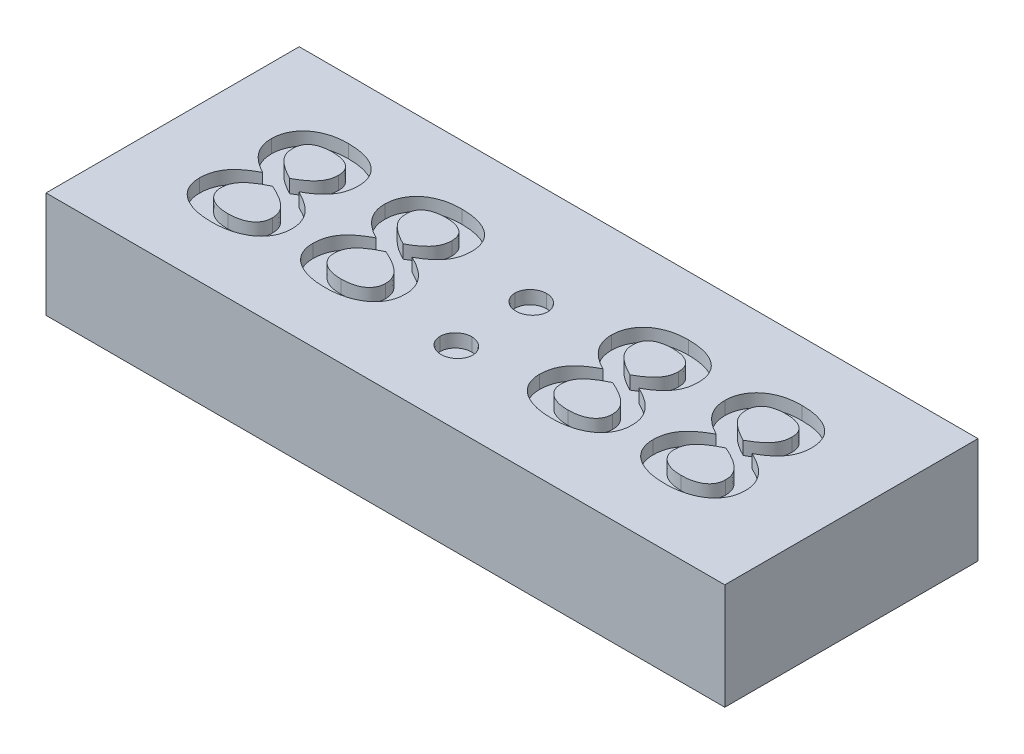
from build123d import *

# Parameters (mm, degrees)
SKETCH1_W           = 51.2
SKETCH1_H           = 19.1
BOSS_EXTRUDE1_DEPTH = 8
CUT_EXTRUDE1_DEPTH  = 1


with BuildPart() as part:
    # Sketch1 → Boss-Extrude1 (new body)
    with BuildSketch(Plane(origin=(0, 0, 0), x_dir=(1, 0, 0), z_dir=(0, 1, 0))):
        with Locations((25.6, 9.55)):
            Rectangle(SKETCH1_W, SKETCH1_H)
    extrude(amount=BOSS_EXTRUDE1_DEPTH)

    # Sketch2 → Cut-Extrude1 (cut)
    # profile 1 of 6: a face of its own
    with BuildSketch(Plane(origin=(0, 8, 0), x_dir=(1, 0, 0), z_dir=(0, 1, 0))):
        with BuildLine():
            add(Edge.make_bspline(
                [(11.616741597, 6.938055716), (11.614070617, 6.83668319), (11.608853593, 6.638679913), (11.55719971, 6.351263833), (11.475585219, 6.081183562), (11.362340457, 5.829091725), (11.21796559, 5.596305898), (11.046741824, 5.382931628), (10.851420863, 5.186004605), (10.627290932, 5.012943543), (10.383503663, 4.855466968), (10.115222336, 4.723591964), (9.829972053, 4.603321067), (9.52197921, 4.510754949), (9.19747259, 4.435759615), (8.858560281, 4.381717349), (8.505943694, 4.349779848), (8.266867884, 4.345250594), (8.145274206, 4.34294702)],
                knots=[0, 0, 0, 0, 1.000052693, 1.953327181, 2.872788888, 3.780118478, 4.673629746, 5.569872142, 6.476313619, 7.405181598, 8.360347939, 9.33693613, 10.352831955, 11.413662562, 12.507440117, 13.639596934, 14.79950176, 16, 16, 16, 16], degree=3))
            add(Edge.make_bspline(
                [(8.145274206, 4.34294702), (8.012328382, 4.344851988), (7.755034304, 4.348538731), (7.380878181, 4.38459316), (7.030424636, 4.4356505), (6.705217621, 4.516167678), (6.405308406, 4.615349798), (6.130563802, 4.7333785), (5.879564374, 4.866714686), (5.653766423, 5.018028988), (5.456473556, 5.189397483), (5.282277172, 5.373638271), (5.133656842, 5.573749412), (5.014045668, 5.789706396), (4.919539334, 6.018258741), (4.8556149, 6.259034913), (4.812374573, 6.510033624), (4.807582488, 6.681227018), (4.805147394, 6.76821876)],
                knots=[0, 0, 0, 0, 1.375053455, 2.661182599, 3.886103685, 5.035847984, 6.122484779, 7.151019323, 8.125850463, 9.059422521, 9.956479377, 10.823913521, 11.678312387, 12.527879149, 13.371936083, 14.230181046, 15.100668371, 16, 16, 16, 16], degree=3))
            add(Edge.make_bspline(
                [(4.805147394, 6.76821876), (4.805963618, 6.842281797), (4.807567724, 6.987836158), (4.834785732, 7.201783243), (4.872219033, 7.408672939), (4.926227231, 7.608174253), (4.997920808, 7.798935921), (5.080071781, 7.983983861), (5.184317545, 8.157789763), (5.299189806, 8.327653812), (5.43534249, 8.488101149), (5.584228721, 8.646896776), (5.751253789, 8.802184627), (5.93550008, 8.952074416), (6.137027044, 9.09805574), (6.353849691, 9.240179371), (6.588243389, 9.378951888), (6.752240869, 9.465900935), (6.836397394, 9.510519484)],
                knots=[0, 0, 0, 0, 0.9817941, 1.929497053, 2.856500519, 3.769882858, 4.666479047, 5.558197062, 6.451263441, 7.351208482, 8.27561226, 9.239003338, 10.238008998, 11.298365388, 12.387964643, 13.537787702, 14.736497464, 16, 16, 16, 16], degree=3))
            add(Edge.make_bspline(
                [(6.836397394, 9.510519484), (6.756763409, 9.552866842), (6.601798715, 9.635273184), (6.381007866, 9.767304862), (6.176726507, 9.903032609), (5.989272847, 10.042916902), (5.817902036, 10.186065284), (5.664209087, 10.333416925), (5.524846991, 10.483111107), (5.362604237, 10.686320845), (5.198868313, 10.958368942), (5.052255626, 11.306865326), (4.967628578, 11.680437283), (4.955987203, 11.936888607), (4.950074931, 12.067131803)],
                knots=[0, 0, 0, 0, 0.965742151, 1.879297357, 2.753639218, 3.591069971, 4.3828202, 5.143208522, 5.869671325, 6.57156934, 7.92459772, 9.2546127, 10.605708044, 12, 12, 12, 12], degree=3))
            add(Edge.make_bspline(
                [(4.950074931, 12.067131803), (4.953070202, 12.148764825), (4.959034, 12.311301988), (4.995451377, 12.553860244), (5.060049035, 12.790660038), (5.14526452, 13.023968196), (5.259610452, 13.246883566), (5.394922441, 13.462080986), (5.559807905, 13.661452669), (5.74912009, 13.848464636), (5.963337707, 14.020133031), (6.20476818, 14.172623778), (6.469522813, 14.308822069), (6.761721988, 14.42365023), (7.078878878, 14.520896773), (7.424746354, 14.583280305), (7.795474014, 14.625981744), (8.051541316, 14.630479513), (8.183770583, 14.632802093)],
                knots=[0, 0, 0, 0, 0.84787631, 1.688182144, 2.539998808, 3.393220902, 4.262601171, 5.136739024, 6.028000719, 6.942569753, 7.896211159, 8.872552016, 9.903233579, 10.98328609, 12.129012318, 13.341973747, 14.627435608, 16, 16, 16, 16], degree=3))
            add(Edge.make_bspline(
                [(8.183770583, 14.632802093), (8.309149164, 14.630634447), (8.552021391, 14.626435475), (8.90447337, 14.593982383), (9.234145031, 14.543591979), (9.539743529, 14.468432686), (9.822301432, 14.375637563), (10.082476562, 14.265318812), (10.317877977, 14.133695214), (10.530844875, 13.985680193), (10.719718595, 13.821076693), (10.881313599, 13.637122569), (11.022297989, 13.439969792), (11.13129635, 13.222517108), (11.221955576, 12.993557654), (11.280843421, 12.748757472), (11.321983338, 12.492741713), (11.325234249, 12.317153511), (11.326886525, 12.227910789)],
                knots=[0, 0, 0, 0, 1.344488315, 2.60442309, 3.792969015, 4.918061287, 5.975373753, 6.979920341, 7.943949441, 8.862512087, 9.75736589, 10.623298353, 11.483497483, 12.348862108, 13.225364058, 14.118751848, 15.043855425, 16, 16, 16, 16], degree=3))
            add(Edge.make_bspline(
                [(11.326886525, 12.227910789), (11.325822205, 12.154626009), (11.323732064, 12.010707253), (11.300078221, 11.798756685), (11.262880578, 11.595447966), (11.206362221, 11.400866347), (11.140574061, 11.213398127), (11.055059947, 11.03506781), (10.955609785, 10.865534322), (10.801820285, 10.647566708), (10.57106611, 10.392081357), (10.248238062, 10.107773709), (9.875465395, 9.840948329), (9.599294428, 9.688847538), (9.45641551, 9.610157165)],
                knots=[0, 0, 0, 0, 0.774346025, 1.520682966, 2.251503645, 2.956246805, 3.660447715, 4.349292367, 5.043110025, 5.73600945, 7.165967233, 8.669478215, 10.276932036, 12, 12, 12, 12], degree=3))
            add(Edge.make_bspline(
                [(9.45641551, 9.610157165), (9.605579079, 9.536165177), (9.898380952, 9.390921986), (10.309139325, 9.138626894), (10.682462397, 8.864338668), (10.951620753, 8.602959166), (11.138653059, 8.380853796), (11.261807789, 8.205328888), (11.368649717, 8.019918858), (11.456199234, 7.823649259), (11.531410069, 7.619622712), (11.579094338, 7.401695637), (11.613027829, 7.173878727), (11.615491338, 7.017446769), (11.616741597, 6.938055716)],
                knots=[0, 0, 0, 0, 1.642200187, 3.223570591, 4.7503837, 6.204073382, 6.912600226, 7.613056352, 8.316988316, 9.020289587, 9.731707272, 10.457979509, 11.217406522, 12, 12, 12, 12], degree=3))
        make_face()
        with BuildLine():
            add(Edge.make_bspline(
                [(9.877611162, 12.182620934), (9.876685369, 12.235573226), (9.874890593, 12.338228372), (9.850312323, 12.485752458), (9.817809639, 12.62395572), (9.767195123, 12.751813563), (9.702247628, 12.869507711), (9.620968355, 12.975165261), (9.527418441, 13.070871724), (9.382500435, 13.187990954), (9.163962583, 13.306760489), (8.860794779, 13.404813539), (8.512048852, 13.462886031), (8.264773499, 13.469750262), (8.133951742, 13.473381803)],
                knots=[0, 0, 0, 0, 0.772738455, 1.498057474, 2.180163254, 2.84373868, 3.500404073, 4.137895351, 4.785232637, 5.451825786, 6.854070669, 8.388647673, 10.089403371, 12, 12, 12, 12], degree=3))
            add(Edge.make_bspline(
                [(8.133951742, 13.473381803), (8.004622347, 13.469777718), (7.759569401, 13.462948707), (7.414270411, 13.404267785), (7.112498601, 13.30879296), (6.895092181, 13.191889022), (6.749672913, 13.077693309), (6.65541499, 12.984067539), (6.575528414, 12.879953613), (6.512950274, 12.764420549), (6.457945604, 12.642172251), (6.427219718, 12.506737872), (6.40193208, 12.363209499), (6.400229302, 12.263520709), (6.399350293, 12.212059339)],
                knots=[0, 0, 0, 0, 1.91446195, 3.627516704, 5.169007738, 6.585059734, 7.253819462, 7.902078826, 8.548310414, 9.189005685, 9.845218274, 10.525835054, 11.239006242, 12, 12, 12, 12], degree=3))
            add(Edge.make_bspline(
                [(6.399350293, 12.212059339), (6.404400239, 12.107377969), (6.414297631, 11.902212885), (6.497736053, 11.605806803), (6.644334962, 11.332981655), (6.851068831, 11.079434879), (7.117542419, 10.84077986), (7.43530157, 10.600295974), (7.817509, 10.366295782), (8.09683739, 10.218432257), (8.244911887, 10.14004847)],
                knots=[0, 0, 0, 0, 0.855423649, 1.676545345, 2.494246317, 3.372850179, 4.338686428, 5.414450719, 6.629377019, 8, 8, 8, 8], degree=3))
            add(Edge.make_bspline(
                [(8.244911887, 10.14004847), (8.375241461, 10.212695306), (8.623212056, 10.350916269), (8.958058254, 10.580701151), (9.241221947, 10.813701471), (9.47619781, 11.052557977), (9.657160514, 11.308188373), (9.786888243, 11.581918186), (9.863807121, 11.876521748), (9.87296144, 12.07951517), (9.877611162, 12.182620934)],
                knots=[0, 0, 0, 0, 1.297113997, 2.467944293, 3.526158232, 4.482572832, 5.373167372, 6.236538477, 7.104290941, 8, 8, 8, 8], degree=3))
        make_face(mode=Mode.SUBTRACT)
        with BuildLine():
            add(Edge.make_bspline(
                [(10.167466235, 6.901823832), (10.16326064, 6.992841626), (10.154827752, 7.175346785), (10.09358742, 7.397961735), (10.021725153, 7.571192922), (9.948353898, 7.701402833), (9.854984919, 7.829197786), (9.745029852, 7.956972496), (9.617329864, 8.085285417), (9.467209139, 8.210257368), (9.298868816, 8.338583764), (9.108228112, 8.464281691), (8.894410195, 8.592632627), (8.656531208, 8.723520253), (8.389087389, 8.851794177), (8.202054462, 8.9364688), (8.104513336, 8.98062818)],
                knots=[0, 0, 0, 0, 1.227361749, 2.461055587, 3.091438311, 3.75771563, 4.473384361, 5.225159627, 6.032379059, 6.914620528, 7.86051044, 8.889517349, 9.996022338, 11.227609097, 12.55414695, 14, 14, 14, 14], degree=3))
            add(Edge.make_bspline(
                [(8.104513336, 8.98062818), (8.021240533, 8.940353077), (7.859538461, 8.862145459), (7.629298232, 8.740917734), (7.420009742, 8.618422286), (7.177602659, 8.460197444), (6.913082811, 8.266799381), (6.657555756, 8.015711267), (6.465157949, 7.758445265), (6.336736372, 7.489798479), (6.267086742, 7.207335435), (6.258696087, 7.015418082), (6.254422757, 6.917675281)],
                knots=[0, 0, 0, 0, 0.943368346, 1.831865993, 2.653115838, 3.415419435, 4.784210071, 5.987266204, 7.055884212, 8.044200493, 9.003918514, 10, 10, 10, 10], degree=3))
            add(Edge.make_bspline(
                [(6.254422757, 6.917675281), (6.255790707, 6.862396758), (6.258472428, 6.754029053), (6.290500294, 6.597230349), (6.333520047, 6.448241809), (6.401562887, 6.311726904), (6.48266024, 6.184744917), (6.579137781, 6.068310517), (6.688583669, 5.961542791), (6.85400176, 5.828835049), (7.101361487, 5.696519748), (7.436774963, 5.581195322), (7.812830834, 5.514742297), (8.075574498, 5.506575159), (8.210944496, 5.50236731)],
                knots=[0, 0, 0, 0, 0.734446881, 1.439805529, 2.122996951, 2.79246048, 3.461245307, 4.124955764, 4.799824334, 5.493278862, 6.941275336, 8.504365142, 10.198989568, 12, 12, 12, 12], degree=3))
            add(Edge.make_bspline(
                [(8.210944496, 5.50236731), (8.342533091, 5.505935519), (8.599029991, 5.512890791), (8.968684713, 5.57659876), (9.303068194, 5.681079206), (9.554242578, 5.802960941), (9.721450362, 5.930812886), (9.837492313, 6.03048082), (9.931052189, 6.149300958), (10.017321234, 6.273656485), (10.085608527, 6.412135186), (10.132690979, 6.564233508), (10.163394628, 6.72848583), (10.166079812, 6.842800514), (10.167466235, 6.901823832)],
                knots=[0, 0, 0, 0, 1.750641714, 3.412409478, 4.972656889, 6.406140501, 7.095417535, 7.771309275, 8.435144008, 9.101180268, 9.784204059, 10.480113466, 11.215247397, 12, 12, 12, 12], degree=3))
        make_face(mode=Mode.SUBTRACT)
    # profile 2 of 6: a face of its own
    with BuildSketch(Plane(origin=(0, 8, 0), x_dir=(1, 0, 0), z_dir=(0, 1, 0))):
        with BuildLine():
            add(Edge.make_bspline(
                [(20.167466235, 6.938055716), (20.164795254, 6.83668319), (20.15957823, 6.638679913), (20.107924348, 6.351263833), (20.026309857, 6.081183562), (19.913065095, 5.829091725), (19.768690228, 5.596305898), (19.597466462, 5.382931628), (19.402145501, 5.186004605), (19.17801557, 5.012943543), (18.934228301, 4.855466968), (18.665946974, 4.723591964), (18.38069669, 4.603321067), (18.072703847, 4.510754949), (17.748197228, 4.435759615), (17.409284919, 4.381717349), (17.056668332, 4.349779848), (16.817592521, 4.345250594), (16.695998844, 4.34294702)],
                knots=[0, 0, 0, 0, 1.000052693, 1.953327181, 2.872788888, 3.780118478, 4.673629746, 5.569872142, 6.476313619, 7.405181598, 8.360347939, 9.33693613, 10.352831955, 11.413662562, 12.507440117, 13.639596934, 14.79950176, 16, 16, 16, 16], degree=3))
            add(Edge.make_bspline(
                [(16.695998844, 4.34294702), (16.56305302, 4.344851988), (16.305758941, 4.348538731), (15.931602819, 4.38459316), (15.581149274, 4.4356505), (15.255942259, 4.516167678), (14.956033044, 4.615349798), (14.68128844, 4.7333785), (14.430289012, 4.866714686), (14.204491061, 5.018028988), (14.007198194, 5.189397483), (13.83300181, 5.373638271), (13.68438148, 5.573749412), (13.564770305, 5.789706396), (13.470263972, 6.018258741), (13.406339538, 6.259034913), (13.363099211, 6.510033624), (13.358307125, 6.681227018), (13.355872032, 6.76821876)],
                knots=[0, 0, 0, 0, 1.375053455, 2.661182599, 3.886103685, 5.035847984, 6.122484779, 7.151019323, 8.125850463, 9.059422521, 9.956479377, 10.823913521, 11.678312387, 12.527879149, 13.371936083, 14.230181046, 15.100668371, 16, 16, 16, 16], degree=3))
            add(Edge.make_bspline(
                [(13.355872032, 6.76821876), (13.356688256, 6.842281797), (13.358292361, 6.987836158), (13.38551037, 7.201783243), (13.422943671, 7.408672939), (13.476951868, 7.608174253), (13.548645445, 7.798935921), (13.630796418, 7.983983861), (13.735042183, 8.157789763), (13.849914443, 8.327653812), (13.986067127, 8.488101149), (14.134953358, 8.646896776), (14.301978427, 8.802184627), (14.486224718, 8.952074416), (14.687751681, 9.09805574), (14.904574329, 9.240179371), (15.138968027, 9.378951888), (15.302965507, 9.465900935), (15.387122032, 9.510519484)],
                knots=[0, 0, 0, 0, 0.9817941, 1.929497053, 2.856500519, 3.769882858, 4.666479047, 5.558197062, 6.451263441, 7.351208482, 8.27561226, 9.239003338, 10.238008998, 11.298365388, 12.387964643, 13.537787702, 14.736497464, 16, 16, 16, 16], degree=3))
            add(Edge.make_bspline(
                [(15.387122032, 9.510519484), (15.307488047, 9.552866842), (15.152523352, 9.635273184), (14.931732504, 9.767304862), (14.727451145, 9.903032609), (14.539997485, 10.042916902), (14.368626673, 10.186065284), (14.214933725, 10.333416925), (14.075571629, 10.483111107), (13.913328875, 10.686320845), (13.74959295, 10.958368942), (13.602980264, 11.306865326), (13.518353216, 11.680437283), (13.50671184, 11.936888607), (13.500799568, 12.067131803)],
                knots=[0, 0, 0, 0, 0.965742151, 1.879297357, 2.753639218, 3.591069971, 4.3828202, 5.143208522, 5.869671325, 6.57156934, 7.92459772, 9.2546127, 10.605708044, 12, 12, 12, 12], degree=3))
            add(Edge.make_bspline(
                [(13.500799568, 12.067131803), (13.503794839, 12.148764825), (13.509758638, 12.311301988), (13.546176014, 12.553860244), (13.610773673, 12.790660038), (13.695989158, 13.023968196), (13.81033509, 13.246883566), (13.945647079, 13.462080986), (14.110532543, 13.661452669), (14.299844728, 13.848464636), (14.514062345, 14.020133031), (14.755492818, 14.172623778), (15.020247451, 14.308822069), (15.312446625, 14.42365023), (15.629603516, 14.520896773), (15.975470991, 14.583280305), (16.346198652, 14.625981744), (16.602265954, 14.630479513), (16.73449522, 14.632802093)],
                knots=[0, 0, 0, 0, 0.84787631, 1.688182144, 2.539998808, 3.393220902, 4.262601171, 5.136739024, 6.028000719, 6.942569753, 7.896211159, 8.872552016, 9.903233579, 10.98328609, 12.129012318, 13.341973747, 14.627435608, 16, 16, 16, 16], degree=3))
            add(Edge.make_bspline(
                [(16.73449522, 14.632802093), (16.859873801, 14.630634447), (17.102746028, 14.626435475), (17.455198008, 14.593982383), (17.784869669, 14.543591979), (18.090468167, 14.468432686), (18.37302607, 14.375637563), (18.633201199, 14.265318812), (18.868602615, 14.133695214), (19.081569513, 13.985680193), (19.270443233, 13.821076693), (19.432038237, 13.637122569), (19.573022626, 13.439969792), (19.682020987, 13.222517108), (19.772680213, 12.993557654), (19.831568059, 12.748757472), (19.872707976, 12.492741713), (19.875958887, 12.317153511), (19.877611162, 12.227910789)],
                knots=[0, 0, 0, 0, 1.344488315, 2.60442309, 3.792969015, 4.918061287, 5.975373753, 6.979920341, 7.943949441, 8.862512087, 9.75736589, 10.623298353, 11.483497483, 12.348862108, 13.225364058, 14.118751848, 15.043855425, 16, 16, 16, 16], degree=3))
            add(Edge.make_bspline(
                [(19.877611162, 12.227910789), (19.876546843, 12.154626009), (19.874456701, 12.010707253), (19.850802858, 11.798756685), (19.813605216, 11.595447966), (19.757086859, 11.400866347), (19.691298699, 11.213398127), (19.605784585, 11.03506781), (19.506334423, 10.865534322), (19.352544923, 10.647566708), (19.121790748, 10.392081357), (18.7989627, 10.107773709), (18.426190033, 9.840948329), (18.150019065, 9.688847538), (18.007140148, 9.610157165)],
                knots=[0, 0, 0, 0, 0.774346025, 1.520682966, 2.251503645, 2.956246805, 3.660447715, 4.349292367, 5.043110025, 5.73600945, 7.165967233, 8.669478215, 10.276932036, 12, 12, 12, 12], degree=3))
            add(Edge.make_bspline(
                [(18.007140148, 9.610157165), (18.156303716, 9.536165177), (18.44910559, 9.390921986), (18.859863963, 9.138626894), (19.233187035, 8.864338668), (19.502345391, 8.602959166), (19.689377697, 8.380853796), (19.812532427, 8.205328888), (19.919374354, 8.019918858), (20.006923872, 7.823649259), (20.082134707, 7.619622712), (20.129818975, 7.401695637), (20.163752467, 7.173878727), (20.166215975, 7.017446769), (20.167466235, 6.938055716)],
                knots=[0, 0, 0, 0, 1.642200187, 3.223570591, 4.7503837, 6.204073382, 6.912600226, 7.613056352, 8.316988316, 9.020289587, 9.731707272, 10.457979509, 11.217406522, 12, 12, 12, 12], degree=3))
        make_face()
        with BuildLine():
            add(Edge.make_bspline(
                [(18.4283358, 12.182620934), (18.427410006, 12.235573226), (18.42561523, 12.338228372), (18.401036961, 12.485752458), (18.368534277, 12.62395572), (18.31791976, 12.751813563), (18.252972265, 12.869507711), (18.171692993, 12.975165261), (18.078143078, 13.070871724), (17.933225073, 13.187990954), (17.714687221, 13.306760489), (17.411519417, 13.404813539), (17.062773489, 13.462886031), (16.815498137, 13.469750262), (16.68467638, 13.473381803)],
                knots=[0, 0, 0, 0, 0.772738455, 1.498057474, 2.180163254, 2.84373868, 3.500404073, 4.137895351, 4.785232637, 5.451825786, 6.854070669, 8.388647673, 10.089403371, 12, 12, 12, 12], degree=3))
            add(Edge.make_bspline(
                [(16.68467638, 13.473381803), (16.555346985, 13.469777718), (16.310294039, 13.462948707), (15.964995048, 13.404267785), (15.663223239, 13.30879296), (15.445816819, 13.191889022), (15.300397551, 13.077693309), (15.206139628, 12.984067539), (15.126253051, 12.879953613), (15.063674912, 12.764420549), (15.008670241, 12.642172251), (14.977944356, 12.506737872), (14.952656718, 12.363209499), (14.950953939, 12.263520709), (14.950074931, 12.212059339)],
                knots=[0, 0, 0, 0, 1.91446195, 3.627516704, 5.169007738, 6.585059734, 7.253819462, 7.902078826, 8.548310414, 9.189005685, 9.845218274, 10.525835054, 11.239006242, 12, 12, 12, 12], degree=3))
            add(Edge.make_bspline(
                [(14.950074931, 12.212059339), (14.955124876, 12.107377969), (14.965022269, 11.902212885), (15.048460691, 11.605806803), (15.1950596, 11.332981655), (15.401793469, 11.079434879), (15.668267057, 10.84077986), (15.986026208, 10.600295974), (16.368233638, 10.366295782), (16.647562027, 10.218432257), (16.795636525, 10.14004847)],
                knots=[0, 0, 0, 0, 0.855423649, 1.676545345, 2.494246317, 3.372850179, 4.338686428, 5.414450719, 6.629377019, 8, 8, 8, 8], degree=3))
            add(Edge.make_bspline(
                [(16.795636525, 10.14004847), (16.925966099, 10.212695306), (17.173936694, 10.350916269), (17.508782891, 10.580701151), (17.791946585, 10.813701471), (18.026922448, 11.052557977), (18.207885151, 11.308188373), (18.33761288, 11.581918186), (18.414531759, 11.876521748), (18.423686078, 12.07951517), (18.4283358, 12.182620934)],
                knots=[0, 0, 0, 0, 1.297113997, 2.467944293, 3.526158232, 4.482572832, 5.373167372, 6.236538477, 7.104290941, 8, 8, 8, 8], degree=3))
        make_face(mode=Mode.SUBTRACT)
        with BuildLine():
            add(Edge.make_bspline(
                [(18.718190873, 6.901823832), (18.713985277, 6.992841626), (18.70555239, 7.175346785), (18.644312058, 7.397961735), (18.572449791, 7.571192922), (18.499078536, 7.701402833), (18.405709556, 7.829197786), (18.29575449, 7.956972496), (18.168054502, 8.085285417), (18.017933777, 8.210257368), (17.849593454, 8.338583764), (17.658952749, 8.464281691), (17.445134832, 8.592632627), (17.207255846, 8.723520253), (16.939812027, 8.851794177), (16.752779099, 8.9364688), (16.655237974, 8.98062818)],
                knots=[0, 0, 0, 0, 1.227361749, 2.461055587, 3.091438311, 3.75771563, 4.473384361, 5.225159627, 6.032379059, 6.914620528, 7.86051044, 8.889517349, 9.996022338, 11.227609097, 12.55414695, 14, 14, 14, 14], degree=3))
            add(Edge.make_bspline(
                [(16.655237974, 8.98062818), (16.571965171, 8.940353077), (16.410263099, 8.862145459), (16.180022869, 8.740917734), (15.97073438, 8.618422286), (15.728327297, 8.460197444), (15.463807449, 8.266799381), (15.208280394, 8.015711267), (15.015882587, 7.758445265), (14.887461009, 7.489798479), (14.81781138, 7.207335435), (14.809420724, 7.015418082), (14.805147394, 6.917675281)],
                knots=[0, 0, 0, 0, 0.943368346, 1.831865993, 2.653115838, 3.415419435, 4.784210071, 5.987266204, 7.055884212, 8.044200493, 9.003918514, 10, 10, 10, 10], degree=3))
            add(Edge.make_bspline(
                [(14.805147394, 6.917675281), (14.806515344, 6.862396758), (14.809197066, 6.754029053), (14.841224932, 6.597230349), (14.884244685, 6.448241809), (14.952287524, 6.311726904), (15.033384878, 6.184744917), (15.129862419, 6.068310517), (15.239308307, 5.961542791), (15.404726398, 5.828835049), (15.652086125, 5.696519748), (15.987499601, 5.581195322), (16.363555471, 5.514742297), (16.626299136, 5.506575159), (16.761669133, 5.50236731)],
                knots=[0, 0, 0, 0, 0.734446881, 1.439805529, 2.122996951, 2.79246048, 3.461245307, 4.124955764, 4.799824334, 5.493278862, 6.941275336, 8.504365142, 10.198989568, 12, 12, 12, 12], degree=3))
            add(Edge.make_bspline(
                [(16.761669133, 5.50236731), (16.893257729, 5.505935519), (17.149754628, 5.512890791), (17.51940935, 5.57659876), (17.853792832, 5.681079206), (18.104967215, 5.802960941), (18.272175, 5.930812886), (18.388216951, 6.03048082), (18.481776826, 6.149300958), (18.568045872, 6.273656485), (18.636333165, 6.412135186), (18.683415617, 6.564233508), (18.714119266, 6.72848583), (18.71680445, 6.842800514), (18.718190873, 6.901823832)],
                knots=[0, 0, 0, 0, 1.750641714, 3.412409478, 4.972656889, 6.406140501, 7.095417535, 7.771309275, 8.435144008, 9.101180268, 9.784204059, 10.480113466, 11.215247397, 12, 12, 12, 12], degree=3))
        make_face(mode=Mode.SUBTRACT)
    # profile 3 of 6: a face of its own
    with BuildSketch(Plane(origin=(0, 8, 0), x_dir=(1, 0, 0), z_dir=(0, 1, 0))):
        with BuildLine():
            add(Edge.make_bspline(
                [(25.452792322, 12.313961513), (25.534220156, 12.31021325), (25.696648138, 12.302736412), (25.927275113, 12.223882816), (26.141094827, 12.118983627), (26.324159887, 11.972359666), (26.478847336, 11.79995018), (26.592338082, 11.598707419), (26.675998904, 11.381201736), (26.684806758, 11.227013313), (26.689205365, 11.150012238)],
                knots=[0, 0, 0, 0, 1.03805877, 2.070665301, 3.090177312, 4.073776561, 5.05243068, 6.034890955, 7.018632483, 8, 8, 8, 8], degree=3))
            add(Edge.make_bspline(
                [(26.689205365, 11.150012238), (26.684815367, 11.072285842), (26.676067397, 10.917400065), (26.593626296, 10.699776577), (26.477199545, 10.501907697), (26.325094675, 10.329544746), (26.140108917, 10.186284192), (25.928249109, 10.079223203), (25.695749935, 10.007755166), (25.534067093, 9.999347368), (25.452792322, 9.995120934)],
                knots=[0, 0, 0, 0, 0.99328342, 1.97932082, 2.947369016, 3.928307134, 4.908241343, 5.930132708, 6.959518591, 8, 8, 8, 8], degree=3))
            add(Edge.make_bspline(
                [(25.452792322, 9.995120934), (25.370054728, 9.999333322), (25.20695112, 10.007637355), (24.974016943, 10.077336304), (24.766571916, 10.189250423), (24.580225521, 10.327693999), (24.431532162, 10.503084444), (24.312251876, 10.698256124), (24.240616339, 10.91886474), (24.23052522, 11.072532516), (24.225437249, 11.150012238)],
                knots=[0, 0, 0, 0, 1.061689416, 2.092946697, 3.090868209, 4.080268414, 5.056602708, 6.026410791, 7.004910816, 8, 8, 8, 8], degree=3))
            add(Edge.make_bspline(
                [(24.225437249, 11.150012238), (24.230522493, 11.226770657), (24.240657135, 11.37974645), (24.313486498, 11.600248689), (24.429905415, 11.798758741), (24.581149568, 11.974211469), (24.765609387, 12.115997718), (24.974970745, 12.225823285), (25.206042384, 12.302889423), (25.369897118, 12.310241864), (25.452792322, 12.313961513)],
                knots=[0, 0, 0, 0, 0.983153109, 1.959376292, 2.943624147, 3.917686639, 4.910696166, 5.906295645, 6.940780997, 8, 8, 8, 8], degree=3))
        make_face()
    # profile 4 of 6: a face of its own
    with BuildSketch(Plane(origin=(0, 8, 0), x_dir=(1, 0, 0), z_dir=(0, 1, 0))):
        with BuildLine():
            add(Edge.make_bspline(
                [(25.452792322, 6.6617876), (25.534220156, 6.658039337), (25.696648138, 6.650562499), (25.927275113, 6.571708903), (26.141094827, 6.466809714), (26.324159887, 6.320185753), (26.478847336, 6.147776266), (26.592338082, 5.946533506), (26.675998904, 5.729027823), (26.684806758, 5.5748394), (26.689205365, 5.497838325)],
                knots=[0, 0, 0, 0, 1.03805877, 2.070665301, 3.090177312, 4.073776561, 5.05243068, 6.034890955, 7.018632483, 8, 8, 8, 8], degree=3))
            add(Edge.make_bspline(
                [(26.689205365, 5.497838325), (26.684815367, 5.420111929), (26.676067397, 5.265226152), (26.593626296, 5.047602664), (26.477199545, 4.849733784), (26.325094675, 4.677370833), (26.140108917, 4.534110279), (25.928249109, 4.42704929), (25.695749935, 4.355581253), (25.534067093, 4.347173455), (25.452792322, 4.34294702)],
                knots=[0, 0, 0, 0, 0.99328342, 1.97932082, 2.947369016, 3.928307134, 4.908241343, 5.930132708, 6.959518591, 8, 8, 8, 8], degree=3))
            add(Edge.make_bspline(
                [(25.452792322, 4.34294702), (25.370054728, 4.347159409), (25.20695112, 4.355463442), (24.974016943, 4.425162391), (24.766571916, 4.53707651), (24.580225521, 4.675520086), (24.431532162, 4.850910531), (24.312251876, 5.046082211), (24.240616339, 5.266690827), (24.23052522, 5.420358603), (24.225437249, 5.497838325)],
                knots=[0, 0, 0, 0, 1.061689416, 2.092946697, 3.090868209, 4.080268414, 5.056602708, 6.026410791, 7.004910816, 8, 8, 8, 8], degree=3))
            add(Edge.make_bspline(
                [(24.225437249, 5.497838325), (24.230522493, 5.574596744), (24.240657135, 5.727572537), (24.313486498, 5.948074776), (24.429905415, 6.146584828), (24.581149568, 6.322037556), (24.765609387, 6.463823805), (24.974970745, 6.573649372), (25.206042384, 6.65071551), (25.369897118, 6.658067951), (25.452792322, 6.6617876)],
                knots=[0, 0, 0, 0, 0.983153109, 1.959376292, 2.943624147, 3.917686639, 4.910696166, 5.906295645, 6.940780997, 8, 8, 8, 8], degree=3))
        make_face()
    # profile 5 of 6: a face of its own
    with BuildSketch(Plane(origin=(0, 8, 0), x_dir=(1, 0, 0), z_dir=(0, 1, 0))):
        with BuildLine():
            add(Edge.make_bspline(
                [(37.26891551, 6.938055716), (37.26624453, 6.83668319), (37.261027506, 6.638679913), (37.209373623, 6.351263833), (37.127759132, 6.081183562), (37.01451437, 5.829091725), (36.870139503, 5.596305898), (36.698915737, 5.382931628), (36.503594777, 5.186004605), (36.279464845, 5.012943543), (36.035677576, 4.855466968), (35.767396249, 4.723591964), (35.482145966, 4.603321067), (35.174153123, 4.510754949), (34.849646503, 4.435759615), (34.510734194, 4.381717349), (34.158117607, 4.349779848), (33.919041797, 4.345250594), (33.797448119, 4.34294702)],
                knots=[0, 0, 0, 0, 1.000052693, 1.953327181, 2.872788888, 3.780118478, 4.673629746, 5.569872142, 6.476313619, 7.405181598, 8.360347939, 9.33693613, 10.352831955, 11.413662562, 12.507440117, 13.639596934, 14.79950176, 16, 16, 16, 16], degree=3))
            add(Edge.make_bspline(
                [(33.797448119, 4.34294702), (33.664502295, 4.344851988), (33.407208217, 4.348538731), (33.033052094, 4.38459316), (32.682598549, 4.4356505), (32.357391535, 4.516167678), (32.057482319, 4.615349798), (31.782737715, 4.7333785), (31.531738287, 4.866714686), (31.305940336, 5.018028988), (31.108647469, 5.189397483), (30.934451085, 5.373638271), (30.785830755, 5.573749412), (30.666219581, 5.789706396), (30.571713247, 6.018258741), (30.507788813, 6.259034913), (30.464548486, 6.510033624), (30.459756401, 6.681227018), (30.457321307, 6.76821876)],
                knots=[0, 0, 0, 0, 1.375053455, 2.661182599, 3.886103685, 5.035847984, 6.122484779, 7.151019323, 8.125850463, 9.059422521, 9.956479377, 10.823913521, 11.678312387, 12.527879149, 13.371936083, 14.230181046, 15.100668371, 16, 16, 16, 16], degree=3))
            add(Edge.make_bspline(
                [(30.457321307, 6.76821876), (30.458137531, 6.842281797), (30.459741637, 6.987836158), (30.486959645, 7.201783243), (30.524392947, 7.408672939), (30.578401144, 7.608174253), (30.650094721, 7.798935921), (30.732245694, 7.983983861), (30.836491458, 8.157789763), (30.951363719, 8.327653812), (31.087516403, 8.488101149), (31.236402634, 8.646896776), (31.403427702, 8.802184627), (31.587673993, 8.952074416), (31.789200957, 9.09805574), (32.006023604, 9.240179371), (32.240417302, 9.378951888), (32.404414782, 9.465900935), (32.488571307, 9.510519484)],
                knots=[0, 0, 0, 0, 0.9817941, 1.929497053, 2.856500519, 3.769882858, 4.666479047, 5.558197062, 6.451263441, 7.351208482, 8.27561226, 9.239003338, 10.238008998, 11.298365388, 12.387964643, 13.537787702, 14.736497464, 16, 16, 16, 16], degree=3))
            add(Edge.make_bspline(
                [(32.488571307, 9.510519484), (32.408937322, 9.552866842), (32.253972628, 9.635273184), (32.033181779, 9.767304862), (31.82890042, 9.903032609), (31.64144676, 10.042916902), (31.470075949, 10.186065284), (31.316383, 10.333416925), (31.177020904, 10.483111107), (31.01477815, 10.686320845), (30.851042226, 10.958368942), (30.704429539, 11.306865326), (30.619802491, 11.680437283), (30.608161116, 11.936888607), (30.602248844, 12.067131803)],
                knots=[0, 0, 0, 0, 0.965742151, 1.879297357, 2.753639218, 3.591069971, 4.3828202, 5.143208522, 5.869671325, 6.57156934, 7.92459772, 9.2546127, 10.605708044, 12, 12, 12, 12], degree=3))
            add(Edge.make_bspline(
                [(30.602248844, 12.067131803), (30.605244115, 12.148764825), (30.611207913, 12.311301988), (30.64762529, 12.553860244), (30.712222948, 12.790660038), (30.797438433, 13.023968196), (30.911784365, 13.246883566), (31.047096354, 13.462080986), (31.211981818, 13.661452669), (31.401294004, 13.848464636), (31.61551162, 14.020133031), (31.856942093, 14.172623778), (32.121696726, 14.308822069), (32.413895901, 14.42365023), (32.731052791, 14.520896773), (33.076920267, 14.583280305), (33.447647927, 14.625981744), (33.70371523, 14.630479513), (33.835944496, 14.632802093)],
                knots=[0, 0, 0, 0, 0.84787631, 1.688182144, 2.539998808, 3.393220902, 4.262601171, 5.136739024, 6.028000719, 6.942569753, 7.896211159, 8.872552016, 9.903233579, 10.98328609, 12.129012318, 13.341973747, 14.627435608, 16, 16, 16, 16], degree=3))
            add(Edge.make_bspline(
                [(33.835944496, 14.632802093), (33.961323077, 14.630634447), (34.204195304, 14.626435475), (34.556647283, 14.593982383), (34.886318944, 14.543591979), (35.191917442, 14.468432686), (35.474475346, 14.375637563), (35.734650475, 14.265318812), (35.97005189, 14.133695214), (36.183018788, 13.985680193), (36.371892508, 13.821076693), (36.533487512, 13.637122569), (36.674471902, 13.439969792), (36.783470263, 13.222517108), (36.874129489, 12.993557654), (36.933017334, 12.748757472), (36.974157251, 12.492741713), (36.977408162, 12.317153511), (36.979060438, 12.227910789)],
                knots=[0, 0, 0, 0, 1.344488315, 2.60442309, 3.792969015, 4.918061287, 5.975373753, 6.979920341, 7.943949441, 8.862512087, 9.75736589, 10.623298353, 11.483497483, 12.348862108, 13.225364058, 14.118751848, 15.043855425, 16, 16, 16, 16], degree=3))
            add(Edge.make_bspline(
                [(36.979060438, 12.227910789), (36.977996118, 12.154626009), (36.975905977, 12.010707253), (36.952252134, 11.798756685), (36.915054491, 11.595447966), (36.858536134, 11.400866347), (36.792747974, 11.213398127), (36.707233861, 11.03506781), (36.607783698, 10.865534322), (36.453994198, 10.647566708), (36.223240023, 10.392081357), (35.900411975, 10.107773709), (35.527639308, 9.840948329), (35.251468341, 9.688847538), (35.108589423, 9.610157165)],
                knots=[0, 0, 0, 0, 0.774346025, 1.520682966, 2.251503645, 2.956246805, 3.660447715, 4.349292367, 5.043110025, 5.73600945, 7.165967233, 8.669478215, 10.276932036, 12, 12, 12, 12], degree=3))
            add(Edge.make_bspline(
                [(35.108589423, 9.610157165), (35.257752992, 9.536165177), (35.550554865, 9.390921986), (35.961313238, 9.138626894), (36.33463631, 8.864338668), (36.603794666, 8.602959166), (36.790826972, 8.380853796), (36.913981702, 8.205328888), (37.02082363, 8.019918858), (37.108373147, 7.823649259), (37.183583982, 7.619622712), (37.231268251, 7.401695637), (37.265201742, 7.173878727), (37.267665251, 7.017446769), (37.26891551, 6.938055716)],
                knots=[0, 0, 0, 0, 1.642200187, 3.223570591, 4.7503837, 6.204073382, 6.912600226, 7.613056352, 8.316988316, 9.020289587, 9.731707272, 10.457979509, 11.217406522, 12, 12, 12, 12], degree=3))
        make_face()
        with BuildLine():
            add(Edge.make_bspline(
                [(35.529785075, 12.182620934), (35.528859282, 12.235573226), (35.527064506, 12.338228372), (35.502486236, 12.485752458), (35.469983552, 12.62395572), (35.419369036, 12.751813563), (35.354421541, 12.869507711), (35.273142268, 12.975165261), (35.179592354, 13.070871724), (35.034674348, 13.187990954), (34.816136497, 13.306760489), (34.512968692, 13.404813539), (34.164222765, 13.462886031), (33.916947412, 13.469750262), (33.786125655, 13.473381803)],
                knots=[0, 0, 0, 0, 0.772738455, 1.498057474, 2.180163254, 2.84373868, 3.500404073, 4.137895351, 4.785232637, 5.451825786, 6.854070669, 8.388647673, 10.089403371, 12, 12, 12, 12], degree=3))
            add(Edge.make_bspline(
                [(33.786125655, 13.473381803), (33.65679626, 13.469777718), (33.411743314, 13.462948707), (33.066444324, 13.404267785), (32.764672514, 13.30879296), (32.547266094, 13.191889022), (32.401846826, 13.077693309), (32.307588903, 12.984067539), (32.227702327, 12.879953613), (32.165124187, 12.764420549), (32.110119517, 12.642172251), (32.079393631, 12.506737872), (32.054105993, 12.363209499), (32.052403215, 12.263520709), (32.051524206, 12.212059339)],
                knots=[0, 0, 0, 0, 1.91446195, 3.627516704, 5.169007738, 6.585059734, 7.253819462, 7.902078826, 8.548310414, 9.189005685, 9.845218274, 10.525835054, 11.239006242, 12, 12, 12, 12], degree=3))
            add(Edge.make_bspline(
                [(32.051524206, 12.212059339), (32.056574152, 12.107377969), (32.066471544, 11.902212885), (32.149909966, 11.605806803), (32.296508875, 11.332981655), (32.503242744, 11.079434879), (32.769716332, 10.84077986), (33.087475483, 10.600295974), (33.469682913, 10.366295782), (33.749011303, 10.218432257), (33.8970858, 10.14004847)],
                knots=[0, 0, 0, 0, 0.855423649, 1.676545345, 2.494246317, 3.372850179, 4.338686428, 5.414450719, 6.629377019, 8, 8, 8, 8], degree=3))
            add(Edge.make_bspline(
                [(33.8970858, 10.14004847), (34.027415375, 10.212695306), (34.275385969, 10.350916269), (34.610232167, 10.580701151), (34.89339586, 10.813701471), (35.128371723, 11.052557977), (35.309334427, 11.308188373), (35.439062156, 11.581918186), (35.515981034, 11.876521748), (35.525135353, 12.07951517), (35.529785075, 12.182620934)],
                knots=[0, 0, 0, 0, 1.297113997, 2.467944293, 3.526158232, 4.482572832, 5.373167372, 6.236538477, 7.104290941, 8, 8, 8, 8], degree=3))
        make_face(mode=Mode.SUBTRACT)
        with BuildLine():
            add(Edge.make_bspline(
                [(35.819640148, 6.901823832), (35.815434553, 6.992841626), (35.807001665, 7.175346785), (35.745761333, 7.397961735), (35.673899066, 7.571192922), (35.600527811, 7.701402833), (35.507158832, 7.829197786), (35.397203765, 7.956972496), (35.269503778, 8.085285417), (35.119383052, 8.210257368), (34.951042729, 8.338583764), (34.760402025, 8.464281691), (34.546584108, 8.592632627), (34.308705121, 8.723520253), (34.041261302, 8.851794177), (33.854228375, 8.9364688), (33.756687249, 8.98062818)],
                knots=[0, 0, 0, 0, 1.227361749, 2.461055587, 3.091438311, 3.75771563, 4.473384361, 5.225159627, 6.032379059, 6.914620528, 7.86051044, 8.889517349, 9.996022338, 11.227609097, 12.55414695, 14, 14, 14, 14], degree=3))
            add(Edge.make_bspline(
                [(33.756687249, 8.98062818), (33.673414446, 8.940353077), (33.511712374, 8.862145459), (33.281472145, 8.740917734), (33.072183655, 8.618422286), (32.829776572, 8.460197444), (32.565256724, 8.266799381), (32.309729669, 8.015711267), (32.117331862, 7.758445265), (31.988910285, 7.489798479), (31.919260655, 7.207335435), (31.91087, 7.015418082), (31.90659667, 6.917675281)],
                knots=[0, 0, 0, 0, 0.943368346, 1.831865993, 2.653115838, 3.415419435, 4.784210071, 5.987266204, 7.055884212, 8.044200493, 9.003918514, 10, 10, 10, 10], degree=3))
            add(Edge.make_bspline(
                [(31.90659667, 6.917675281), (31.90796462, 6.862396758), (31.910646341, 6.754029053), (31.942674207, 6.597230349), (31.98569396, 6.448241809), (32.0537368, 6.311726904), (32.134834153, 6.184744917), (32.231311694, 6.068310517), (32.340757582, 5.961542791), (32.506175673, 5.828835049), (32.7535354, 5.696519748), (33.088948876, 5.581195322), (33.465004747, 5.514742297), (33.727748411, 5.506575159), (33.863118409, 5.50236731)],
                knots=[0, 0, 0, 0, 0.734446881, 1.439805529, 2.122996951, 2.79246048, 3.461245307, 4.124955764, 4.799824334, 5.493278862, 6.941275336, 8.504365142, 10.198989568, 12, 12, 12, 12], degree=3))
            add(Edge.make_bspline(
                [(33.863118409, 5.50236731), (33.994707005, 5.505935519), (34.251203904, 5.512890791), (34.620858626, 5.57659876), (34.955242107, 5.681079206), (35.206416491, 5.802960941), (35.373624275, 5.930812886), (35.489666226, 6.03048082), (35.583226102, 6.149300958), (35.669495147, 6.273656485), (35.73778244, 6.412135186), (35.784864892, 6.564233508), (35.815568541, 6.72848583), (35.818253725, 6.842800514), (35.819640148, 6.901823832)],
                knots=[0, 0, 0, 0, 1.750641714, 3.412409478, 4.972656889, 6.406140501, 7.095417535, 7.771309275, 8.435144008, 9.101180268, 9.784204059, 10.480113466, 11.215247397, 12, 12, 12, 12], degree=3))
        make_face(mode=Mode.SUBTRACT)
    # profile 6 of 6: a face of its own
    with BuildSketch(Plane(origin=(0, 8, 0), x_dir=(1, 0, 0), z_dir=(0, 1, 0))):
        with BuildLine():
            add(Edge.make_bspline(
                [(45.819640148, 6.938055716), (45.816969167, 6.83668319), (45.811752143, 6.638679913), (45.760098261, 6.351263833), (45.67848377, 6.081183562), (45.565239008, 5.829091725), (45.420864141, 5.596305898), (45.249640375, 5.382931628), (45.054319414, 5.186004605), (44.830189483, 5.012943543), (44.586402214, 4.855466968), (44.318120887, 4.723591964), (44.032870603, 4.603321067), (43.72487776, 4.510754949), (43.400371141, 4.435759615), (43.061458832, 4.381717349), (42.708842245, 4.349779848), (42.469766434, 4.345250594), (42.348172757, 4.34294702)],
                knots=[0, 0, 0, 0, 1.000052693, 1.953327181, 2.872788888, 3.780118478, 4.673629746, 5.569872142, 6.476313619, 7.405181598, 8.360347939, 9.33693613, 10.352831955, 11.413662562, 12.507440117, 13.639596934, 14.79950176, 16, 16, 16, 16], degree=3))
            add(Edge.make_bspline(
                [(42.348172757, 4.34294702), (42.215226933, 4.344851988), (41.957932854, 4.348538731), (41.583776732, 4.38459316), (41.233323187, 4.4356505), (40.908116172, 4.516167678), (40.608206957, 4.615349798), (40.333462353, 4.7333785), (40.082462925, 4.866714686), (39.856664974, 5.018028988), (39.659372107, 5.189397483), (39.485175723, 5.373638271), (39.336555393, 5.573749412), (39.216944218, 5.789706396), (39.122437885, 6.018258741), (39.058513451, 6.259034913), (39.015273124, 6.510033624), (39.010481038, 6.681227018), (39.008045945, 6.76821876)],
                knots=[0, 0, 0, 0, 1.375053455, 2.661182599, 3.886103685, 5.035847984, 6.122484779, 7.151019323, 8.125850463, 9.059422521, 9.956479377, 10.823913521, 11.678312387, 12.527879149, 13.371936083, 14.230181046, 15.100668371, 16, 16, 16, 16], degree=3))
            add(Edge.make_bspline(
                [(39.008045945, 6.76821876), (39.008862169, 6.842281797), (39.010466275, 6.987836158), (39.037684283, 7.201783243), (39.075117584, 7.408672939), (39.129125781, 7.608174253), (39.200819358, 7.798935921), (39.282970331, 7.983983861), (39.387216096, 8.157789763), (39.502088356, 8.327653812), (39.63824104, 8.488101149), (39.787127271, 8.646896776), (39.95415234, 8.802184627), (40.138398631, 8.952074416), (40.339925594, 9.09805574), (40.556748242, 9.240179371), (40.79114194, 9.378951888), (40.95513942, 9.465900935), (41.039295945, 9.510519484)],
                knots=[0, 0, 0, 0, 0.9817941, 1.929497053, 2.856500519, 3.769882858, 4.666479047, 5.558197062, 6.451263441, 7.351208482, 8.27561226, 9.239003338, 10.238008998, 11.298365388, 12.387964643, 13.537787702, 14.736497464, 16, 16, 16, 16], degree=3))
            add(Edge.make_bspline(
                [(41.039295945, 9.510519484), (40.95966196, 9.552866842), (40.804697265, 9.635273184), (40.583906417, 9.767304862), (40.379625058, 9.903032609), (40.192171398, 10.042916902), (40.020800587, 10.186065284), (39.867107638, 10.333416925), (39.727745542, 10.483111107), (39.565502788, 10.686320845), (39.401766864, 10.958368942), (39.255154177, 11.306865326), (39.170527129, 11.680437283), (39.158885753, 11.936888607), (39.152973481, 12.067131803)],
                knots=[0, 0, 0, 0, 0.965742151, 1.879297357, 2.753639218, 3.591069971, 4.3828202, 5.143208522, 5.869671325, 6.57156934, 7.92459772, 9.2546127, 10.605708044, 12, 12, 12, 12], degree=3))
            add(Edge.make_bspline(
                [(39.152973481, 12.067131803), (39.155968752, 12.148764825), (39.161932551, 12.311301988), (39.198349928, 12.553860244), (39.262947586, 12.790660038), (39.348163071, 13.023968196), (39.462509003, 13.246883566), (39.597820992, 13.462080986), (39.762706456, 13.661452669), (39.952018641, 13.848464636), (40.166236258, 14.020133031), (40.407666731, 14.172623778), (40.672421364, 14.308822069), (40.964620538, 14.42365023), (41.281777429, 14.520896773), (41.627644904, 14.583280305), (41.998372565, 14.625981744), (42.254439867, 14.630479513), (42.386669133, 14.632802093)],
                knots=[0, 0, 0, 0, 0.84787631, 1.688182144, 2.539998808, 3.393220902, 4.262601171, 5.136739024, 6.028000719, 6.942569753, 7.896211159, 8.872552016, 9.903233579, 10.98328609, 12.129012318, 13.341973747, 14.627435608, 16, 16, 16, 16], degree=3))
            add(Edge.make_bspline(
                [(42.386669133, 14.632802093), (42.512047714, 14.630634447), (42.754919942, 14.626435475), (43.107371921, 14.593982383), (43.437043582, 14.543591979), (43.74264208, 14.468432686), (44.025199983, 14.375637563), (44.285375112, 14.265318812), (44.520776528, 14.133695214), (44.733743426, 13.985680193), (44.922617146, 13.821076693), (45.08421215, 13.637122569), (45.225196539, 13.439969792), (45.3341949, 13.222517108), (45.424854126, 12.993557654), (45.483741972, 12.748757472), (45.524881889, 12.492741713), (45.5281328, 12.317153511), (45.529785075, 12.227910789)],
                knots=[0, 0, 0, 0, 1.344488315, 2.60442309, 3.792969015, 4.918061287, 5.975373753, 6.979920341, 7.943949441, 8.862512087, 9.75736589, 10.623298353, 11.483497483, 12.348862108, 13.225364058, 14.118751848, 15.043855425, 16, 16, 16, 16], degree=3))
            add(Edge.make_bspline(
                [(45.529785075, 12.227910789), (45.528720756, 12.154626009), (45.526630614, 12.010707253), (45.502976771, 11.798756685), (45.465779129, 11.595447966), (45.409260772, 11.400866347), (45.343472612, 11.213398127), (45.257958498, 11.03506781), (45.158508336, 10.865534322), (45.004718836, 10.647566708), (44.773964661, 10.392081357), (44.451136613, 10.107773709), (44.078363946, 9.840948329), (43.802192978, 9.688847538), (43.659314061, 9.610157165)],
                knots=[0, 0, 0, 0, 0.774346025, 1.520682966, 2.251503645, 2.956246805, 3.660447715, 4.349292367, 5.043110025, 5.73600945, 7.165967233, 8.669478215, 10.276932036, 12, 12, 12, 12], degree=3))
            add(Edge.make_bspline(
                [(43.659314061, 9.610157165), (43.808477629, 9.536165177), (44.101279503, 9.390921986), (44.512037876, 9.138626894), (44.885360948, 8.864338668), (45.154519304, 8.602959166), (45.34155161, 8.380853796), (45.46470634, 8.205328888), (45.571548267, 8.019918858), (45.659097785, 7.823649259), (45.73430862, 7.619622712), (45.781992888, 7.401695637), (45.81592638, 7.173878727), (45.818389889, 7.017446769), (45.819640148, 6.938055716)],
                knots=[0, 0, 0, 0, 1.642200187, 3.223570591, 4.7503837, 6.204073382, 6.912600226, 7.613056352, 8.316988316, 9.020289587, 9.731707272, 10.457979509, 11.217406522, 12, 12, 12, 12], degree=3))
        make_face()
        with BuildLine():
            add(Edge.make_bspline(
                [(44.080509713, 12.182620934), (44.079583919, 12.235573226), (44.077789143, 12.338228372), (44.053210874, 12.485752458), (44.02070819, 12.62395572), (43.970093674, 12.751813563), (43.905146178, 12.869507711), (43.823866906, 12.975165261), (43.730316991, 13.070871724), (43.585398986, 13.187990954), (43.366861134, 13.306760489), (43.06369333, 13.404813539), (42.714947402, 13.462886031), (42.46767205, 13.469750262), (42.336850293, 13.473381803)],
                knots=[0, 0, 0, 0, 0.772738455, 1.498057474, 2.180163254, 2.84373868, 3.500404073, 4.137895351, 4.785232637, 5.451825786, 6.854070669, 8.388647673, 10.089403371, 12, 12, 12, 12], degree=3))
            add(Edge.make_bspline(
                [(42.336850293, 13.473381803), (42.207520898, 13.469777718), (41.962467952, 13.462948707), (41.617168961, 13.404267785), (41.315397152, 13.30879296), (41.097990732, 13.191889022), (40.952571464, 13.077693309), (40.858313541, 12.984067539), (40.778426964, 12.879953613), (40.715848825, 12.764420549), (40.660844154, 12.642172251), (40.630118269, 12.506737872), (40.604830631, 12.363209499), (40.603127852, 12.263520709), (40.602248844, 12.212059339)],
                knots=[0, 0, 0, 0, 1.91446195, 3.627516704, 5.169007738, 6.585059734, 7.253819462, 7.902078826, 8.548310414, 9.189005685, 9.845218274, 10.525835054, 11.239006242, 12, 12, 12, 12], degree=3))
            add(Edge.make_bspline(
                [(40.602248844, 12.212059339), (40.607298789, 12.107377969), (40.617196182, 11.902212885), (40.700634604, 11.605806803), (40.847233513, 11.332981655), (41.053967382, 11.079434879), (41.32044097, 10.84077986), (41.638200121, 10.600295974), (42.020407551, 10.366295782), (42.299735941, 10.218432257), (42.447810438, 10.14004847)],
                knots=[0, 0, 0, 0, 0.855423649, 1.676545345, 2.494246317, 3.372850179, 4.338686428, 5.414450719, 6.629377019, 8, 8, 8, 8], degree=3))
            add(Edge.make_bspline(
                [(42.447810438, 10.14004847), (42.578140012, 10.212695306), (42.826110607, 10.350916269), (43.160956804, 10.580701151), (43.444120498, 10.813701471), (43.679096361, 11.052557977), (43.860059064, 11.308188373), (43.989786793, 11.581918186), (44.066705672, 11.876521748), (44.075859991, 12.07951517), (44.080509713, 12.182620934)],
                knots=[0, 0, 0, 0, 1.297113997, 2.467944293, 3.526158232, 4.482572832, 5.373167372, 6.236538477, 7.104290941, 8, 8, 8, 8], degree=3))
        make_face(mode=Mode.SUBTRACT)
        with BuildLine():
            add(Edge.make_bspline(
                [(44.370364786, 6.901823832), (44.36615919, 6.992841626), (44.357726303, 7.175346785), (44.296485971, 7.397961735), (44.224623704, 7.571192922), (44.151252449, 7.701402833), (44.057883469, 7.829197786), (43.947928403, 7.956972496), (43.820228415, 8.085285417), (43.67010769, 8.210257368), (43.501767367, 8.338583764), (43.311126662, 8.464281691), (43.097308745, 8.592632627), (42.859429759, 8.723520253), (42.59198594, 8.851794177), (42.404953012, 8.9364688), (42.307411887, 8.98062818)],
                knots=[0, 0, 0, 0, 1.227361749, 2.461055587, 3.091438311, 3.75771563, 4.473384361, 5.225159627, 6.032379059, 6.914620528, 7.86051044, 8.889517349, 9.996022338, 11.227609097, 12.55414695, 14, 14, 14, 14], degree=3))
            add(Edge.make_bspline(
                [(42.307411887, 8.98062818), (42.224139084, 8.940353077), (42.062437012, 8.862145459), (41.832196783, 8.740917734), (41.622908293, 8.618422286), (41.38050121, 8.460197444), (41.115981362, 8.266799381), (40.860454307, 8.015711267), (40.6680565, 7.758445265), (40.539634922, 7.489798479), (40.469985293, 7.207335435), (40.461594637, 7.015418082), (40.457321307, 6.917675281)],
                knots=[0, 0, 0, 0, 0.943368346, 1.831865993, 2.653115838, 3.415419435, 4.784210071, 5.987266204, 7.055884212, 8.044200493, 9.003918514, 10, 10, 10, 10], degree=3))
            add(Edge.make_bspline(
                [(40.457321307, 6.917675281), (40.458689257, 6.862396758), (40.461370979, 6.754029053), (40.493398845, 6.597230349), (40.536418598, 6.448241809), (40.604461437, 6.311726904), (40.685558791, 6.184744917), (40.782036332, 6.068310517), (40.89148222, 5.961542791), (41.056900311, 5.828835049), (41.304260038, 5.696519748), (41.639673514, 5.581195322), (42.015729384, 5.514742297), (42.278473049, 5.506575159), (42.413843046, 5.50236731)],
                knots=[0, 0, 0, 0, 0.734446881, 1.439805529, 2.122996951, 2.79246048, 3.461245307, 4.124955764, 4.799824334, 5.493278862, 6.941275336, 8.504365142, 10.198989568, 12, 12, 12, 12], degree=3))
            add(Edge.make_bspline(
                [(42.413843046, 5.50236731), (42.545431642, 5.505935519), (42.801928541, 5.512890791), (43.171583263, 5.57659876), (43.505966745, 5.681079206), (43.757141128, 5.802960941), (43.924348913, 5.930812886), (44.040390864, 6.03048082), (44.133950739, 6.149300958), (44.220219785, 6.273656485), (44.288507078, 6.412135186), (44.33558953, 6.564233508), (44.366293179, 6.72848583), (44.368978363, 6.842800514), (44.370364786, 6.901823832)],
                knots=[0, 0, 0, 0, 1.750641714, 3.412409478, 4.972656889, 6.406140501, 7.095417535, 7.771309275, 8.435144008, 9.101180268, 9.784204059, 10.480113466, 11.215247397, 12, 12, 12, 12], degree=3))
        make_face(mode=Mode.SUBTRACT)
    extrude(amount=-CUT_EXTRUDE1_DEPTH, mode=Mode.SUBTRACT)


solid = part.part
